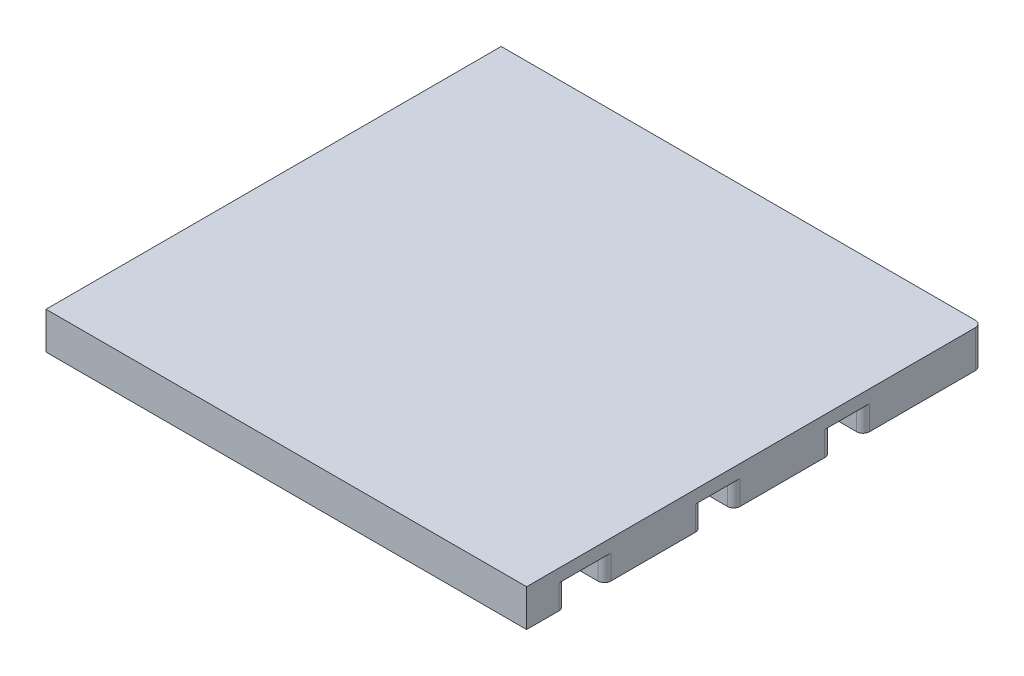
from build123d import *

# Parameters (mm, degrees)
SKETCH3_W           = 149
SKETCH3_H           = 141.12
BOSS_EXTRUDE1_DEPTH = 4
SKETCH5_W           = 67
SKETCH5_H           = 30.2
SKETCH5_H_2         = 36.8
BOSS_EXTRUDE2_DEPTH = 11.55
FILLET1_R           = 2
SKETCH6_W           = 149
SKETCH6_H           = 12
BOSS_EXTRUDE3_DEPTH = 7.5
FILLET2_R           = 2


with BuildPart() as part:
    # Sketch3 → Boss-Extrude1 (new body)
    with BuildSketch(Plane(origin=(0, 0, 0), x_dir=(1, 0, 0), z_dir=(0, 1, 0))):
        with Locations((74.5, -70.56)):
            Rectangle(SKETCH3_W, SKETCH3_H)
    extrude(amount=BOSS_EXTRUDE1_DEPTH)

    # Sketch5 → Boss-Extrude2 (add)
    # profile 1 of 6: a face of its own
    with BuildSketch(Plane(origin=(0, 4, 0), x_dir=(1, 0, 0), z_dir=(0, 1, 0))):
        with Locations((33.5, -25)):
            Rectangle(SKETCH5_W, SKETCH5_H)
        with BuildLine():
            ThreePointArc((12.85, -27.8), (11.05, -26), (12.85, -24.2))
            Line((12.85, -24.2), (40.15, -24.2))
            ThreePointArc((40.15, -24.2), (41.95, -26), (40.15, -27.8))
            Line((40.15, -27.8), (12.85, -27.8))
        make_face(mode=Mode.SUBTRACT)
    # profile 2 of 6: a face of its own
    with BuildSketch(Plane(origin=(0, 4, 0), x_dir=(1, 0, 0), z_dir=(0, 1, 0))):
        with Locations((115.5, -18.4)):
            Rectangle(SKETCH5_W, SKETCH5_H_2)
        with BuildLine():
            ThreePointArc((97.3, -24.5), (95.5, -22.7), (97.3, -20.9))
            Line((97.3, -20.9), (124.6, -20.9))
            ThreePointArc((124.6, -20.9), (126.4, -22.7), (124.6, -24.5))
            Line((124.6, -24.5), (97.3, -24.5))
        make_face(mode=Mode.SUBTRACT)
    # profile 3 of 6: a face of its own
    with BuildSketch(Plane(origin=(0, 4, 0), x_dir=(1, 0, 0), z_dir=(0, 1, 0))):
        with Locations((33.5, -65.1)):
            Rectangle(SKETCH5_W, SKETCH5_H)
        with BuildLine():
            ThreePointArc((12.85, -67.9), (11.05, -66.1), (12.85, -64.3))
            Line((12.85, -64.3), (40.15, -64.3))
            ThreePointArc((40.15, -64.3), (41.95, -66.1), (40.15, -67.9))
            Line((40.15, -67.9), (12.85, -67.9))
        make_face(mode=Mode.SUBTRACT)
    # profile 4 of 6: a face of its own
    with BuildSketch(Plane(origin=(0, 4, 0), x_dir=(1, 0, 0), z_dir=(0, 1, 0))):
        with Locations((115.5, -61.8)):
            Rectangle(SKETCH5_W, SKETCH5_H)
        with BuildLine():
            ThreePointArc((97.3, -64.6), (95.5, -62.8), (97.3, -61))
            Line((97.3, -61), (124.6, -61))
            ThreePointArc((124.6, -61), (126.4, -62.8), (124.6, -64.6))
            Line((124.6, -64.6), (97.3, -64.6))
        make_face(mode=Mode.SUBTRACT)
    # profile 5 of 6: a face of its own
    with BuildSketch(Plane(origin=(0, 4, 0), x_dir=(1, 0, 0), z_dir=(0, 1, 0))):
        with Locations((33.5, -105.2)):
            Rectangle(SKETCH5_W, SKETCH5_H)
        with BuildLine():
            ThreePointArc((12.85, -108), (11.05, -106.2), (12.85, -104.4))
            Line((12.85, -104.4), (40.15, -104.4))
            ThreePointArc((40.15, -104.4), (41.95, -106.2), (40.15, -108))
            Line((40.15, -108), (12.85, -108))
        make_face(mode=Mode.SUBTRACT)
    # profile 6 of 6: a face of its own
    with BuildSketch(Plane(origin=(0, 4, 0), x_dir=(1, 0, 0), z_dir=(0, 1, 0))):
        with Locations((115.5, -101.9)):
            Rectangle(SKETCH5_W, SKETCH5_H)
        with BuildLine():
            ThreePointArc((97.3, -104.7), (95.5, -102.9), (97.3, -101.1))
            Line((97.3, -101.1), (124.6, -101.1))
            ThreePointArc((124.6, -101.1), (126.4, -102.9), (124.6, -104.7))
            Line((124.6, -104.7), (97.3, -104.7))
        make_face(mode=Mode.SUBTRACT)
    extrude(amount=-BOSS_EXTRUDE2_DEPTH)

    # Fillet1
    fillet1_edges = [part.edges().sort_by_distance(p)[0] for p in [
        (67, -3.775, 50),
        (67, -3.775, 80.2),
        (0, -3.775, 80.2),
        (0, -3.775, 50),
        (82, -3.775, 46.7),
        (149, -3.775, 46.7),
        (149, -3.775, 76.9),
        (82, -3.775, 76.9),
        (67, -3.775, 90.1),
        (67, -3.775, 120.3),
        (0, -3.775, 120.3),
        (0, -3.775, 90.1),
        (82, -3.775, 86.8),
        (149, -3.775, 86.8),
        (149, -3.775, 117),
        (82, -3.775, 117),
        (67, -3.775, 9.9),
        (67, -3.775, 40.1),
        (0, -3.775, 40.1),
        (0, -3.775, 9.9),
        (82, -3.775, 0),
        (149, -3.775, 36.8),
        (82, -3.775, 36.8),
        (149, -1.775, 0),
    ]]
    fillet(fillet1_edges, radius=FILLET1_R)

    # Sketch6 → Boss-Extrude3 (add)
    with BuildSketch(Plane.XZ):
        with Locations((74.5, 135.12)):
            Rectangle(SKETCH6_W, SKETCH6_H)
    extrude(amount=BOSS_EXTRUDE3_DEPTH)

    # Fillet2
    fillet2_edges = [part.edges().sort_by_distance(p)[0] for p in [
        (0, -3.75, 129.12),
        (149, -3.75, 129.12),
    ]]
    fillet(fillet2_edges, radius=FILLET2_R)


solid = part.part
